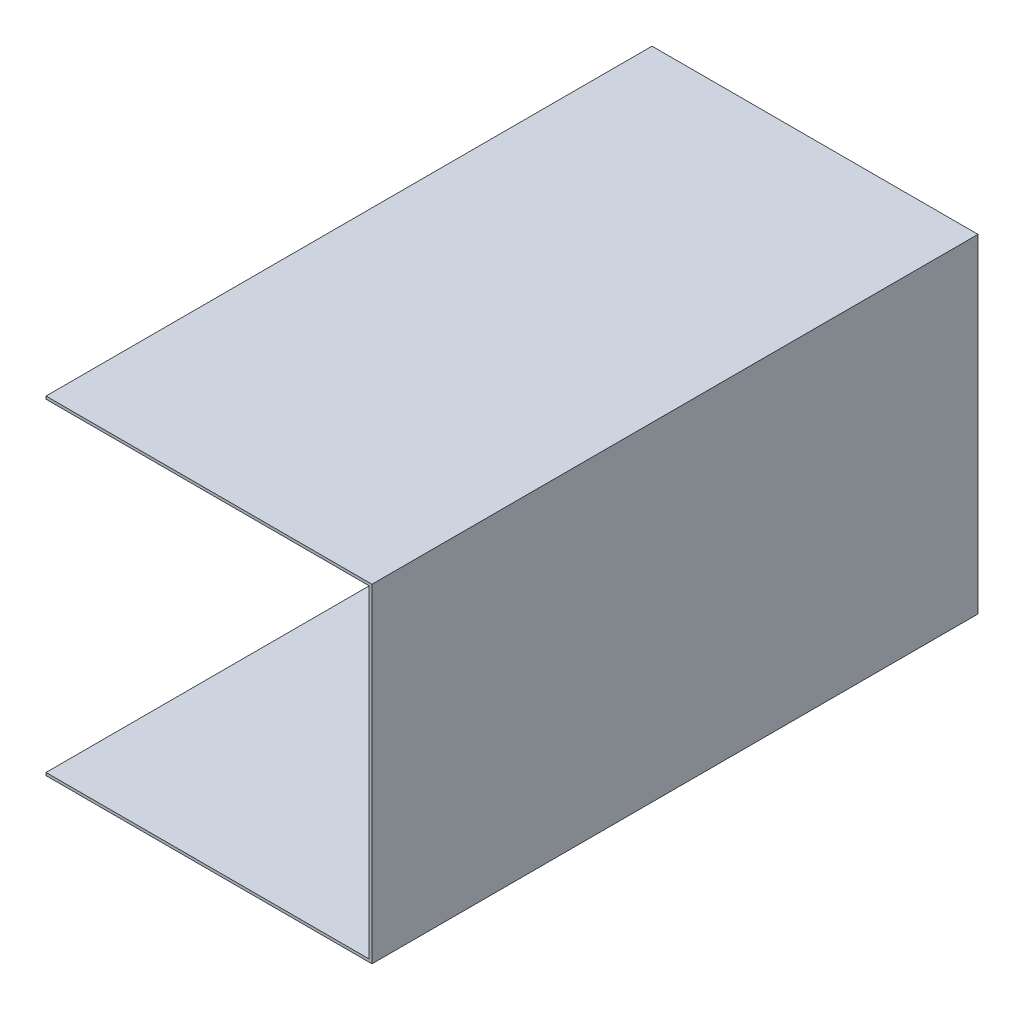
from build123d import *

# Parameters (mm, degrees)
BOSS_EXTRUDE1_DEPTH = 1200


with BuildPart() as part:
    # Sketch1 → Boss-Extrude1 (new body)
    with BuildSketch(Plane.XY):
        Polygon((-320, 320), (-320, 325.5), (325.5, 325.5), (325.5, -325.5), (-320, -325.5), (-320, -320), (320, -320), (320, 320), align=None)
    extrude(amount=BOSS_EXTRUDE1_DEPTH)


solid = part.part
